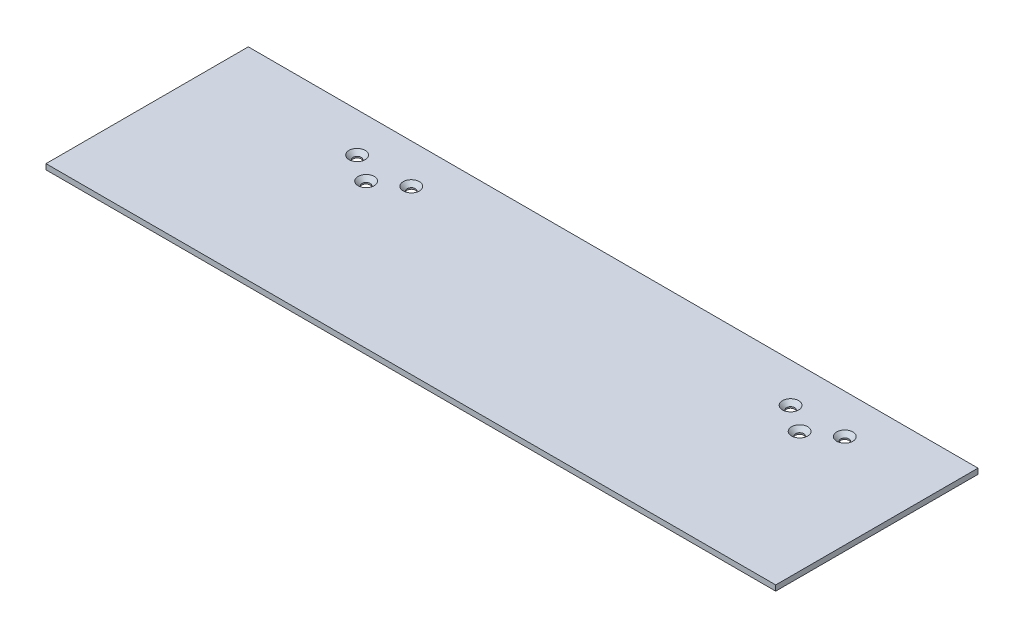
from build123d import *

# Parameters (mm, degrees)
SKETCH1_W                    = 404
SKETCH1_H                    = 112
BOSS_EXTRUDE1_DEPTH          = 3
CSK_FOR_M4_SFHCS1_AT_2_COUNT = 2
CSK_FOR_M4_SFHCS1_AT_2_PITCH = 30
CSK_FOR_M4_SFHCS1_AT_3_COUNT = 2
CSK_FOR_M4_SFHCS1_AT_3_PITCH = 18.027756377
LPATTERN1_COUNT              = 2
LPATTERN1_PITCH              = 240


with BuildPart() as part:
    # Sketch1 → Boss-Extrude1 (new body)
    with BuildSketch(Plane(origin=(0, 0, 0), x_dir=(1, 0, 0), z_dir=(0, 1, 0))):
        Rectangle(SKETCH1_W, SKETCH1_H)
    extrude(amount=BOSS_EXTRUDE1_DEPTH)

    # Sketch3 → CSK for M4 SFHCS1 (revolve, cut)
    with BuildSketch(Plane(origin=(120, 3, -34.25), x_dir=(0, 0, 1), z_dir=(1, 0, 0))):
        Polygon((0, 0), (0, 3), (2.25, 3), (2.25, 2.23), (4.48, 0), align=None)
    csk_for_m4_sfhcs1 = revolve(axis=Axis((120, 9.35, -34.25), (0, -1, 0)), mode=Mode.SUBTRACT)

    # CSK for M4 SFHCS1 at 2: CSK for M4 SFHCS1 ×2
    with Locations(*[(i * CSK_FOR_M4_SFHCS1_AT_2_PITCH, 0, 0) for i in range(1, CSK_FOR_M4_SFHCS1_AT_2_COUNT)]):
        add(csk_for_m4_sfhcs1, mode=Mode.SUBTRACT)

    # CSK for M4 SFHCS1 at 3: CSK for M4 SFHCS1 ×2
    with Locations(*[Vector(0.832050294337843, 0, 0.55470019622523) * (i * CSK_FOR_M4_SFHCS1_AT_3_PITCH) for i in range(1, CSK_FOR_M4_SFHCS1_AT_3_COUNT)]):
        add(csk_for_m4_sfhcs1, mode=Mode.SUBTRACT)

    # LPattern1: CSK for M4 SFHCS1 ×2
    with Locations(*[(-i * LPATTERN1_PITCH, 0, 0) for i in range(1, LPATTERN1_COUNT)]):
        add(csk_for_m4_sfhcs1, mode=Mode.SUBTRACT)

    # LPattern1 copy 1 sketch → LPattern1 copy 1 (revolve, cut)
    with BuildSketch(Plane(origin=(-90, 3, -34.25), x_dir=(0, 0, 1), z_dir=(1, 0, 0))):
        Polygon((0, 0), (0, 3), (2.25, 3), (2.25, 2.23), (4.48, 0), align=None)
    revolve(axis=Axis((-90, 9.35, -34.25), (0, -1, 0)), mode=Mode.SUBTRACT)

    # LPattern1 copy 2 sketch → LPattern1 copy 2 (revolve, cut)
    with BuildSketch(Plane(origin=(-105, 3, -24.25), x_dir=(0, 0, 1), z_dir=(1, 0, 0))):
        Polygon((0, 0), (0, 3), (2.25, 3), (2.25, 2.23), (4.48, 0), align=None)
    revolve(axis=Axis((-105, 9.35, -24.25), (0, -1, 0)), mode=Mode.SUBTRACT)


solid = part.part
